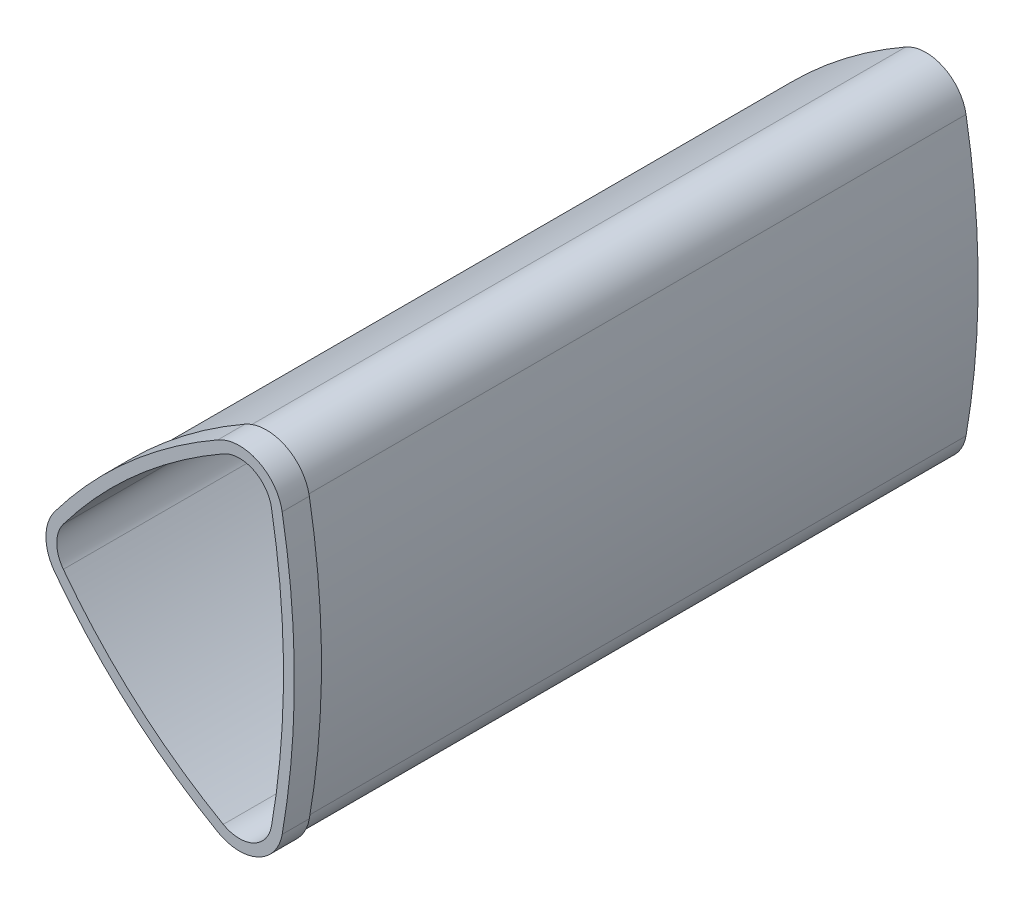
from build123d import *

# Parameters (mm, degrees)
SKETCH1_R           = 12.5
BOSS_EXTRUDE1_DEPTH = 3
BOSS_EXTRUDE2_START = 3
BOSS_EXTRUDE2_DEPTH = 250
BOSS_EXTRUDE3_START = 243
BOSS_EXTRUDE3_DEPTH = 10


with BuildPart() as part:
    # Sketch1 → Boss-Extrude1 (new body)
    with BuildSketch(Plane(origin=(0, 0, 0), x_dir=(0, 1, 0), z_dir=(0, 0, 1))):
        with BuildLine():
            ThreePointArc((-61.741065417, 0.13908703), (-38.440978301, 32.77013475), (-9.016504978, 60.007603513))
            ThreePointArc((-9.016504978, 60.007603513), (0, 63.02), (9.016504978, 60.007603513))
            ThreePointArc((9.016504978, 60.007603513), (38.440978301, 32.77013475), (61.741065417, 0.13908703))
            ThreePointArc((61.741065417, 0.13908703), (62.284318697, -13.672622652), (51.300957447, -22.064536863))
            ThreePointArc((51.300957447, -22.064536863), (0, -26.52870698), (-51.300957447, -22.064536863))
            ThreePointArc((-51.300957447, -22.064536863), (-62.284318697, -13.672622652), (-61.741065417, 0.13908703))
        make_face()
        with Locations(Location((0, 0, 0), (0, 0, 270))):
            Circle(SKETCH1_R, mode=Mode.SUBTRACT)
    extrude(amount=BOSS_EXTRUDE1_DEPTH)

    # Sketch1<3> → Boss-Extrude2 (add)
    with BuildSketch(Plane(origin=(0, 0, 0), x_dir=(0, 1, 0), z_dir=(0, 0, 1)).offset(BOSS_EXTRUDE2_START)):
        with BuildLine():
            Line((0, 60.02), (0, 63.02))
            ThreePointArc((0, 63.02), (-4.75320667, 62.246982335), (-9.016504978, 60.007603513))
            ThreePointArc((-9.016504978, 60.007603513), (-38.440978301, 32.77013475), (-61.741065417, 0.13908703))
            ThreePointArc((-61.741065417, 0.13908703), (-62.284318697, -13.672622652), (-51.300957447, -22.064536863))
            ThreePointArc((-51.300957447, -22.064536863), (-25.747412733, -25.410559647), (0, -26.52870698))
            Line((0, -26.52870698), (0, -23.52870698))
            ThreePointArc((0, -23.52870698), (-25.487337857, -22.421854065), (-50.782765957, -19.10962949))
            ThreePointArc((-50.782765957, -19.10962949), (-59.569454957, -12.396098122), (-59.134852334, -1.346730376))
            ThreePointArc((-59.134852334, -1.346730376), (-36.189588879, 30.787397836), (-7.213203982, 57.610082811))
            ThreePointArc((-7.213203982, 57.610082811), (-3.802565336, 59.401585868), (0, 60.02))
        make_face()
        with BuildLine():
            ThreePointArc((9.016504978, 60.007603513), (4.75320667, 62.246982335), (0, 63.02))
            Line((0, 63.02), (0, 60.02))
            ThreePointArc((0, 60.02), (3.802565336, 59.401585868), (7.213203982, 57.610082811))
            ThreePointArc((7.213203982, 57.610082811), (36.189588879, 30.787397836), (59.134852334, -1.346730376))
            ThreePointArc((59.134852334, -1.346730376), (59.569454957, -12.396098122), (50.782765957, -19.10962949))
            ThreePointArc((50.782765957, -19.10962949), (25.487337857, -22.421854065), (0, -23.52870698))
            Line((0, -23.52870698), (0, -26.52870698))
            ThreePointArc((0, -26.52870698), (25.747412733, -25.410559647), (51.300957447, -22.064536863))
            ThreePointArc((51.300957447, -22.064536863), (62.284318697, -13.672622652), (61.741065417, 0.13908703))
            ThreePointArc((61.741065417, 0.13908703), (38.440978301, 32.77013475), (9.016504978, 60.007603513))
        make_face()
    extrude(amount=BOSS_EXTRUDE2_DEPTH)

    # Sketch1<4> → Boss-Extrude3 (add)
    with BuildSketch(Plane(origin=(0, 0, 0), x_dir=(0, 1, 0), z_dir=(0, 0, 1)).offset(BOSS_EXTRUDE3_START)):
        with BuildLine():
            Line((0, 63.02), (0, 64.02))
            ThreePointArc((0, 64.02), (-5.070087115, 63.195447824), (-9.617605309, 60.806777081))
            ThreePointArc((-9.617605309, 60.806777081), (-39.191441441, 33.431047055), (-62.609803112, 0.634359498))
            ThreePointArc((-62.609803112, 0.634359498), (-63.189273276, -14.098130829), (-51.473687943, -23.049505987))
            ThreePointArc((-51.473687943, -23.049505987), (-25.834104358, -26.406794841), (0, -27.52870698))
            Line((0, -27.52870698), (0, -26.52870698))
            ThreePointArc((0, -26.52870698), (-25.747412733, -25.410559647), (-51.300957447, -22.064536863))
            ThreePointArc((-51.300957447, -22.064536863), (-62.284318697, -13.672622652), (-61.741065417, 0.13908703))
            ThreePointArc((-61.741065417, 0.13908703), (-38.440978301, 32.77013475), (-9.016504978, 60.007603513))
            ThreePointArc((-9.016504978, 60.007603513), (-4.75320667, 62.246982335), (0, 63.02))
        make_face()
        with BuildLine():
            ThreePointArc((9.617605309, 60.806777081), (5.070087115, 63.195447824), (0, 64.02))
            Line((0, 64.02), (0, 63.02))
            ThreePointArc((0, 63.02), (4.75320667, 62.246982335), (9.016504978, 60.007603513))
            ThreePointArc((9.016504978, 60.007603513), (38.440978301, 32.77013475), (61.741065417, 0.13908703))
            ThreePointArc((61.741065417, 0.13908703), (62.284318697, -13.672622652), (51.300957447, -22.064536863))
            ThreePointArc((51.300957447, -22.064536863), (25.747412733, -25.410559647), (0, -26.52870698))
            Line((0, -26.52870698), (0, -27.52870698))
            ThreePointArc((0, -27.52870698), (25.834104358, -26.406794841), (51.473687943, -23.049505987))
            ThreePointArc((51.473687943, -23.049505987), (63.189273276, -14.098130829), (62.609803112, 0.634359498))
            ThreePointArc((62.609803112, 0.634359498), (39.191441441, 33.431047055), (9.617605309, 60.806777081))
        make_face()
    extrude(amount=BOSS_EXTRUDE3_DEPTH)


solid = part.part
